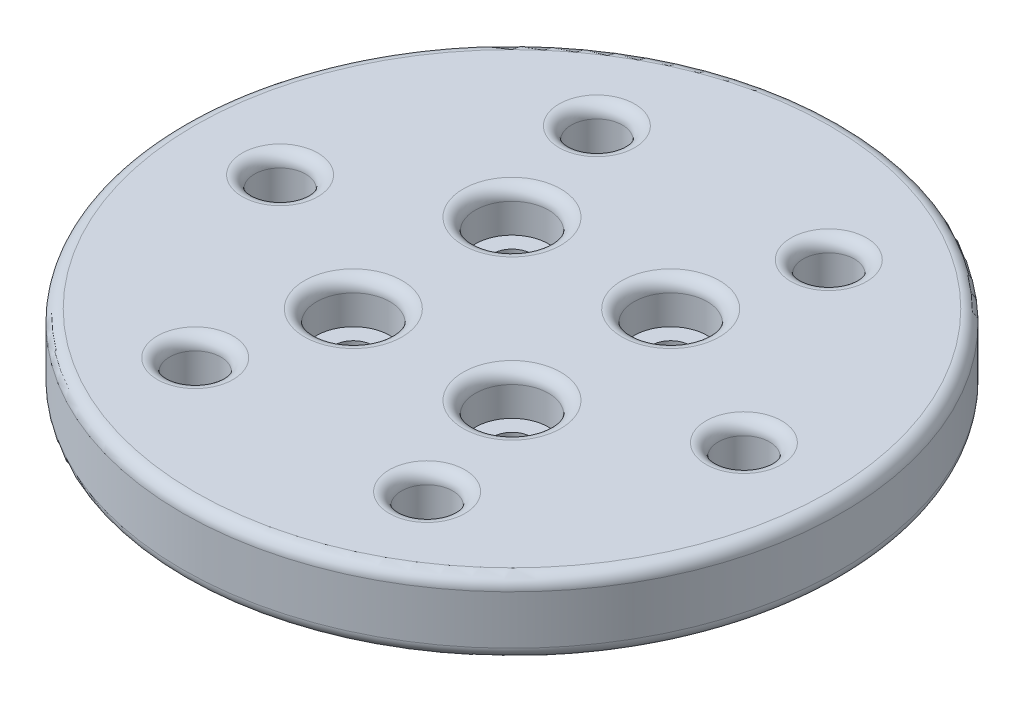
from build123d import *

# Parameters (mm, degrees)
SKETCH_1_R          = 27
SKETCH_1_R_2        = 2.1
EXTRUDE_1_DEPTH     = 6
SKETCH_2_R          = 1.6
CUT_EXTRUDE_1_DEPTH = 39.65229618
SKETCH_3_R          = 3
CUT_EXTRUDE_2_DEPTH = 3.4
FILLET_2_R          = 1


with BuildPart() as part:
    # 草图1 → 凸台-拉伸1 (new body)
    with BuildSketch(Plane(origin=(0, 0, 0), x_dir=(1, 0, 0), z_dir=(0, 1, 0))):
        with Locations(Location((0, 0, 0), (0, 0, 270))):
            Circle(SKETCH_1_R)
        with Locations(Location((19, 0, 0), (0, 0, 270))):
            Circle(SKETCH_1_R_2, mode=Mode.SUBTRACT)
        with Locations(Location((9.5, -16.454482672, 0), (0, 0, 270))):
            Circle(SKETCH_1_R_2, mode=Mode.SUBTRACT)
        with Locations(Location((-9.5, -16.454482672, 0), (0, 0, 270))):
            Circle(SKETCH_1_R_2, mode=Mode.SUBTRACT)
        with Locations(Location((-19, 0, 0), (0, 0, 270))):
            Circle(SKETCH_1_R_2, mode=Mode.SUBTRACT)
        with Locations(Location((-9.5, 16.454482672, 0), (0, 0, 270))):
            Circle(SKETCH_1_R_2, mode=Mode.SUBTRACT)
        with Locations(Location((9.5, 16.454482672, 0), (0, 0, 270))):
            Circle(SKETCH_1_R_2, mode=Mode.SUBTRACT)
    extrude(amount=EXTRUDE_1_DEPTH)

    # 草图2 → 切除-拉伸1 (cut, through all)
    with BuildSketch(Plane(origin=(0, 6, 0), x_dir=(1, 0, 0), z_dir=(0, 1, 0))):
        with Locations(Location((6.5, 6.5, 0), (0, 0, 270))):
            Circle(SKETCH_2_R)
        with Locations(Location((6.5, -6.5, 0), (0, 0, 270))):
            Circle(SKETCH_2_R)
        with Locations(Location((-6.5, -6.5, 0), (0, 0, 270))):
            Circle(SKETCH_2_R)
        with Locations(Location((-6.5, 6.5, 0), (0, 0, 270))):
            Circle(SKETCH_2_R)
    extrude(amount=-CUT_EXTRUDE_1_DEPTH, mode=Mode.SUBTRACT)

    # 草图3 → 切除-拉伸2 (cut)
    with BuildSketch(Plane(origin=(0, 6, 0), x_dir=(1, 0, 0), z_dir=(0, 1, 0))):
        with Locations(Location((6.5, 6.5, 0), (0, 0, 270))):
            Circle(SKETCH_3_R)
        with Locations(Location((6.5, -6.5, 0), (0, 0, 270))):
            Circle(SKETCH_3_R)
        with Locations(Location((-6.5, -6.5, 0), (0, 0, 270))):
            Circle(SKETCH_3_R)
        with Locations(Location((-6.5, 6.5, 0), (0, 0, 270))):
            Circle(SKETCH_3_R)
    extrude(amount=-CUT_EXTRUDE_2_DEPTH, mode=Mode.SUBTRACT)

    # 圆角2
    fillet_2_edges = [part.edges().sort_by_distance(p)[0] for p in [
        (-9.5, 0, 14.354482672),
        (-9.5, 6, 14.354482672),
        (-19, 0, -2.1),
        (-19, 6, -2.1),
        (0, 0, -27),
        (-9.5, 0, -18.554482672),
        (-9.5, 6, -18.554482672),
        (9.5, 0, -18.554482672),
        (9.5, 6, -18.554482672),
        (-6.5, 0, -8.1),
        (-6.5, 0, 4.9),
        (6.5, 0, 4.9),
        (6.5, 0, -8.1),
        (0, 6, -27),
        (19, 0, -2.1),
        (-6.5, 6, -9.5),
        (19, 6, -2.1),
        (-6.5, 6, 3.5),
        (6.5, 6, 3.5),
        (6.5, 6, -9.5),
        (9.5, 0, 14.354482672),
        (9.5, 6, 14.354482672),
    ]]
    fillet(fillet_2_edges, radius=FILLET_2_R)


solid = part.part
